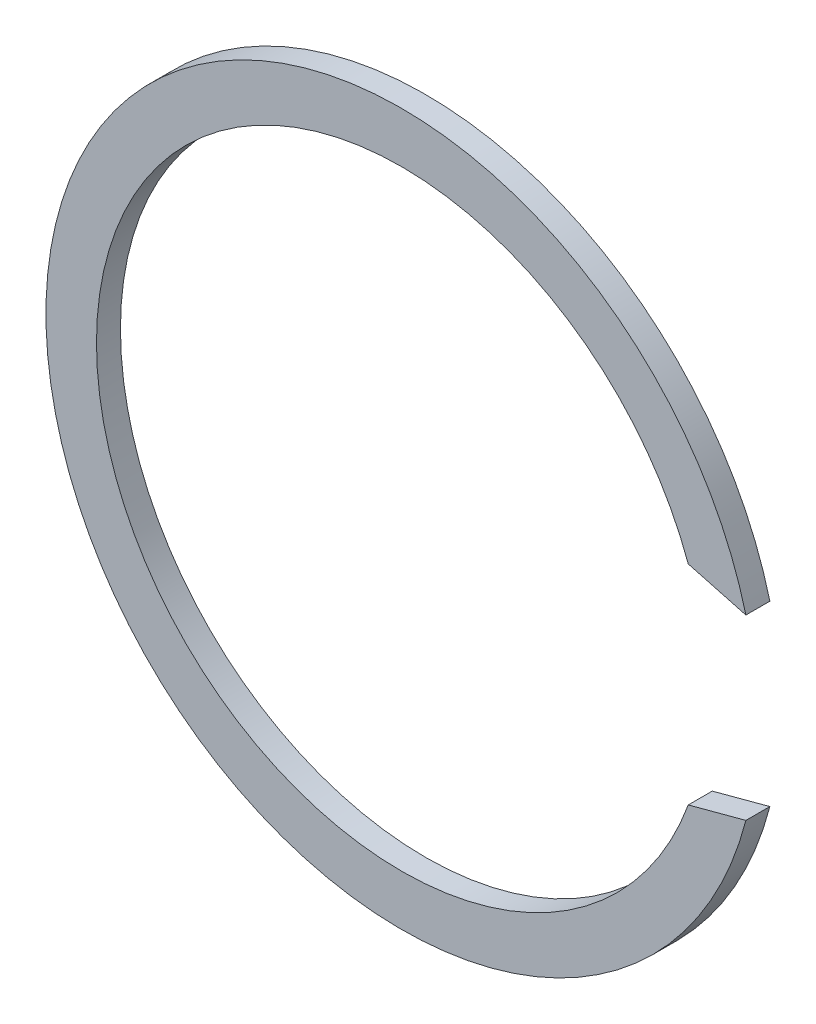
from build123d import *

# Parameters (mm, degrees)
BOSS_EXTRUDE1_DEPTH = 1.205


with BuildPart() as part:
    # Sketch2 → Boss-Extrude1 (new, symmetric)
    with BuildSketch(Plane.XY):
        with BuildLine():
            Line((34.619629886, 8.93875), (28.8250996, 10.491389711))
            ThreePointArc((28.8250996, 10.491389711), (-30.675, 0), (28.8250996, -10.491389711))
            Line((28.8250996, -10.491389711), (34.619629886, -8.93875))
            ThreePointArc((34.619629886, -8.93875), (-35.755, 0), (34.619629886, 8.93875))
        make_face()
    extrude(amount=BOSS_EXTRUDE1_DEPTH, both=True)


solid = part.part
